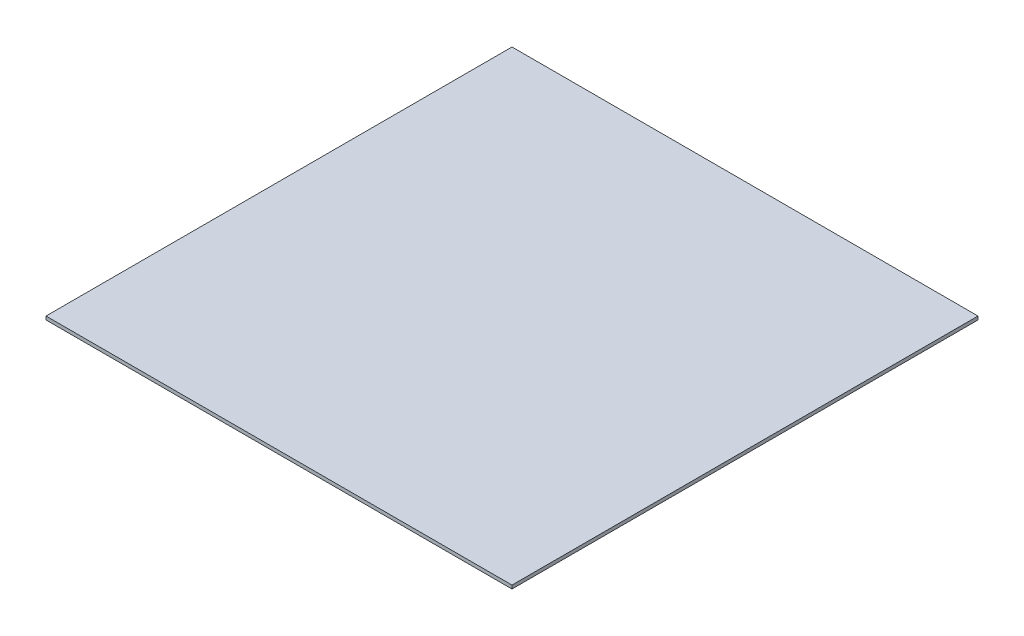
from build123d import *

# Parameters (mm, degrees)
SKETCH1_R           = 2.1
BOSS_EXTRUDE1_DEPTH = 25
SKETCH2_W           = 203.2
SKETCH2_H           = 203.2
BOSS_EXTRUDE2_DEPTH = 1.5
SKETCH3_R           = 10
BOSS_EXTRUDE3_DEPTH = 1


with BuildPart() as part:
    # Sketch1 → Boss-Extrude1 (new body)
    with BuildSketch(Plane(origin=(0, 0, 0), x_dir=(1, 0, 0), z_dir=(0, 1, 0))):
        with Locations(Location((0, 0, 0), (0, 0, 270))):
            Circle(SKETCH1_R)
    extrude(amount=-BOSS_EXTRUDE1_DEPTH)

    # Sketch2 → Boss-Extrude2 (add)
    with BuildSketch(Plane(origin=(0, 0, 0), x_dir=(1, 0, 0), z_dir=(0, 1, 0))):
        Rectangle(SKETCH2_W, SKETCH2_H)
    extrude(amount=BOSS_EXTRUDE2_DEPTH)

    # Sketch3 → Boss-Extrude3 (add)
    with BuildSketch(Plane(origin=(0, 0, 0), x_dir=(1, 0, 0), z_dir=(0, 1, 0))):
        with Locations(Location((0, 0, 0), (0, 0, 270))):
            Circle(SKETCH3_R)
    extrude(amount=-BOSS_EXTRUDE3_DEPTH)


solid = part.part
